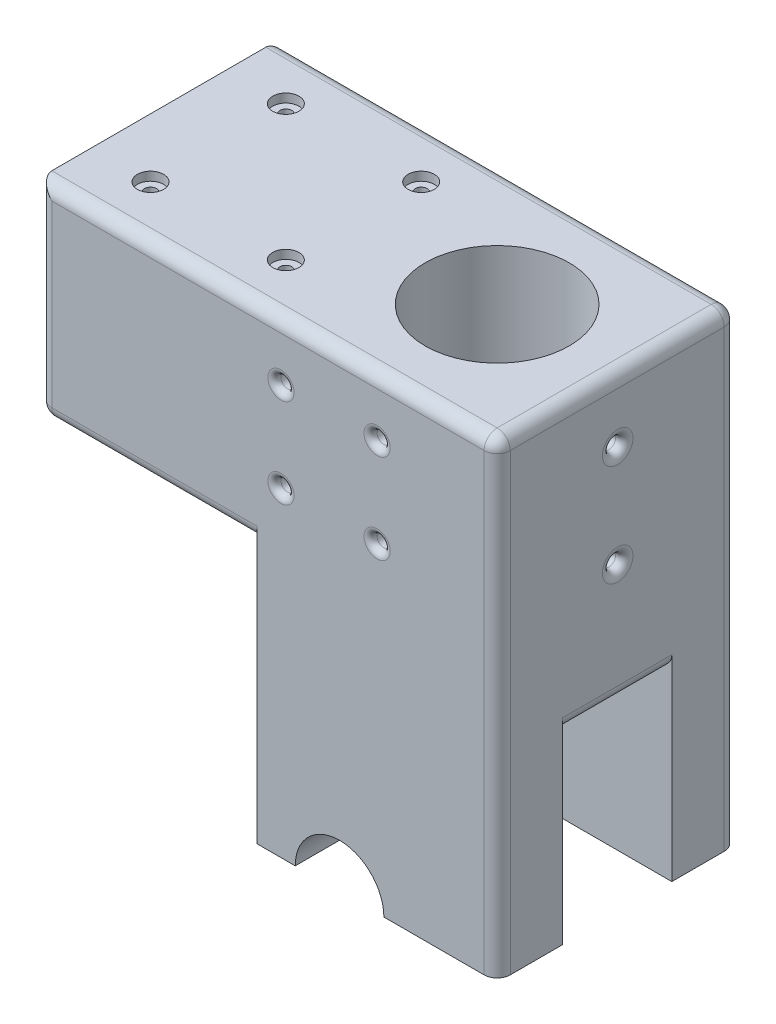
from build123d import *

# Parameters (mm, degrees)
SKETCH1_W               = 65
SKETCH1_H               = 55
BOSS_EXTRUDE1_DEPTH     = 55
SKETCH2_R               = 16.5
CUT_EXTRUDE1_DEPTH      = 55
SKETCH3_W               = 47
SKETCH3_H               = 55
BOSS_EXTRUDE2_DEPTH     = 50
SKETCH5_W               = 42.2
SKETCH5_H               = 42.2
CUT_EXTRUDE2_DEPTH      = 42
SKETCH6_W               = 7.8
SKETCH6_H               = 19.2
CUT_EXTRUDE3_DEPTH      = 42
FILLET2_R               = 3
SKETCH7_W               = 55
SKETCH7_H               = 15
BOSS_EXTRUDE3_DEPTH     = 42
CUT_EXTRUDE4_DEPTH      = 118.976523088
CUT_EXTRUDE4_DEPTH_BACK = 118.976523088
SKETCH9_R               = 10.15
SKETCH10_R              = 1.5
CUT_EXTRUDE5_DEPTH      = 20
FILLET4_R               = 1.5
FILLET5_R               = 3
SKETCH12_R              = 1.35
CUT_EXTRUDE6_DEPTH      = 10
SKETCH13_R              = 3
CUT_EXTRUDE7_DEPTH      = 2
SKETCH15_W              = 20.3
SKETCH15_H              = 3.5
BOSS_EXTRUDE4_DEPTH     = 12
SKETCH16_R              = 1.5
CUT_EXTRUDE8_DEPTH      = 15
FILLET6_R               = 2
SKETCH17_R              = 1.5
CUT_EXTRUDE10_DEPTH     = 15
FILLET7_R               = 1.5


with BuildPart() as part:
    # Sketch1 → Boss-Extrude1 (new body)
    with BuildSketch(Plane(origin=(0, 0, 0), x_dir=(0, 1, 0), z_dir=(0, 0, 1))):
        Rectangle(SKETCH1_W, SKETCH1_H)
    extrude(amount=BOSS_EXTRUDE1_DEPTH)

    # Sketch2 → Cut-Extrude1 (cut)
    with BuildSketch(Plane(origin=(0, 32.5, 0), x_dir=(-1, 0, 0), z_dir=(0, 1, 0))):
        with Locations(Location((0, 27.5, 0), (0, 0, 90))):
            Circle(SKETCH2_R)
    extrude(amount=-CUT_EXTRUDE1_DEPTH, mode=Mode.SUBTRACT)

    # Sketch3 → Boss-Extrude2 (add)
    with BuildSketch(Plane(origin=(-27.5, 0, 0), x_dir=(0, -1, 0), z_dir=(-1, 0, 0))):
        with Locations((-9, 27.5)):
            Rectangle(SKETCH3_W, SKETCH3_H)
    extrude(amount=BOSS_EXTRUDE2_DEPTH)

    # Sketch5 → Cut-Extrude2 (cut)
    with BuildSketch(Plane.XZ.offset(14.5)):
        with Locations((-48.6, 27.5)):
            Rectangle(SKETCH5_W, SKETCH5_H)
    extrude(amount=-CUT_EXTRUDE2_DEPTH, mode=Mode.SUBTRACT)

    # Sketch6 → Cut-Extrude3 (cut)
    with BuildSketch(Plane.XZ.offset(14.5)):
        with Locations((-73.6, 27.5)):
            Rectangle(SKETCH6_W, SKETCH6_H)
    extrude(amount=-CUT_EXTRUDE3_DEPTH, mode=Mode.SUBTRACT)

    # Fillet2
    fillet2_edges = [part.edges().sort_by_distance(p)[0] for p in [
        (-77.5, -14.5, 8.95),
        (-77.5, -14.5, 46.05),
    ]]
    fillet(fillet2_edges, radius=FILLET2_R)

    # Sketch7 → Boss-Extrude3 (add)
    with BuildSketch(Plane.XZ.offset(32.5)):
        with Locations((0, 47.5)):
            Rectangle(SKETCH7_W, SKETCH7_H)
        with Locations((0, 7.5)):
            Rectangle(SKETCH7_W, SKETCH7_H)
    extrude(amount=BOSS_EXTRUDE3_DEPTH)

    # Sketch9 → Cut-Extrude4 (cut, two sides: drawn at the far end of the back side and taken through both)
    with BuildSketch(Plane(origin=(0, 0, 48.6), x_dir=(1, 0, 0), z_dir=(0, 0, -1)).offset(-CUT_EXTRUDE4_DEPTH_BACK)):
        with Locations((-8.6, 74.5)):
            Circle(SKETCH9_R)
    extrude(amount=CUT_EXTRUDE4_DEPTH + CUT_EXTRUDE4_DEPTH_BACK, mode=Mode.SUBTRACT)

    # Sketch10 → Cut-Extrude5 (cut)
    with BuildSketch(Plane.XZ.offset(74.5)):
        with Locations(Location((-23.125, 51.25, 0), (0, 0, 270))):
            Circle(SKETCH10_R)
        with Locations(Location((-23.125, 43.75, 0), (0, 0, 270))):
            Circle(SKETCH10_R)
        with Locations(Location((8.0375, 47.5, 0), (0, 0, 270))):
            Circle(SKETCH10_R)
        with Locations(Location((21.0125, 47.5, 0), (0, 0, 270))):
            Circle(SKETCH10_R)
        with Locations(Location((-23.125, 11.25, 0), (0, 0, 270))):
            Circle(SKETCH10_R)
        with Locations(Location((-23.125, 3.75, 0), (0, 0, 270))):
            Circle(SKETCH10_R)
        with Locations(Location((8.0375, 7.5, 0), (0, 0, 270))):
            Circle(SKETCH10_R)
        with Locations(Location((21.0125, 7.5, 0), (0, 0, 270))):
            Circle(SKETCH10_R)
    extrude(amount=-CUT_EXTRUDE5_DEPTH, mode=Mode.SUBTRACT)

    # Fillet4
    fillet4_edges = [part.edges().sort_by_distance(p)[0] for p in [
        (-23.125, -74.5, 52.75),
        (-23.125, -74.5, 12.75),
        (21.0125, -74.5, 49),
        (8.0375, -74.5, 49),
        (-23.125, -74.5, 45.25),
        (-23.125, -74.5, 5.25),
        (8.0375, -74.5, 9),
        (21.0125, -74.5, 9),
    ]]
    fillet(fillet4_edges, radius=FILLET4_R)

    # Fillet5
    fillet5_edges = [part.edges().sort_by_distance(p)[0] for p in [
        (27.5, -21, 55),
        (-77.5, 10.5, 0),
        (-25, 32.5, 55),
        (27.5, -21, 0),
        (-25, 32.5, 0),
        (-77.5, 10.5, 55),
        (-51, -14.5, 55),
        (-76.621320344, -13.621320344, 55),
        (-51, -14.5, 0),
        (-76.621320344, -13.621320344, 0),
        (27.5, -32.5, 27.5),
        (-27.5, -32.5, 27.5),
        (27.5, 32.5, 27.5),
    ]]
    fillet(fillet5_edges, radius=FILLET5_R)

    # Sketch12 → Cut-Extrude6 (cut)
    with BuildSketch(Plane(origin=(0, 32.5, 0), x_dir=(1, 0, 0), z_dir=(0, 1, 0))):
        with Locations(Location((-33, -42.9, 0), (0, 0, 270))):
            Circle(SKETCH12_R)
        with Locations(Location((-33, -11.9, 0), (0, 0, 270))):
            Circle(SKETCH12_R)
        with Locations(Location((-64, -42.9, 0), (0, 0, 270))):
            Circle(SKETCH12_R)
        with Locations(Location((-64, -11.9, 0), (0, 0, 270))):
            Circle(SKETCH12_R)
    extrude(amount=-CUT_EXTRUDE6_DEPTH, mode=Mode.SUBTRACT)

    # Sketch13 → Cut-Extrude7 (cut)
    with BuildSketch(Plane(origin=(0, 32.5, 0), x_dir=(1, 0, 0), z_dir=(0, 1, 0))):
        with Locations(Location((-33, -42.9, 0), (0, 0, 270))):
            Circle(SKETCH13_R)
        with Locations(Location((-64, -42.9, 0), (0, 0, 270))):
            Circle(SKETCH13_R)
        with Locations(Location((-33, -11.9, 0), (0, 0, 270))):
            Circle(SKETCH13_R)
        with Locations(Location((-64, -11.9, 0), (0, 0, 270))):
            Circle(SKETCH13_R)
    extrude(amount=-CUT_EXTRUDE7_DEPTH, mode=Mode.SUBTRACT)

    # Sketch15 → Boss-Extrude4 (add)
    with BuildSketch(Plane.XZ.offset(74.5)):
        with Locations((-8.6, 1.75)):
            Rectangle(SKETCH15_W, SKETCH15_H)
    extrude(amount=-BOSS_EXTRUDE4_DEPTH)

    # Sketch16 → Cut-Extrude8 (cut)
    with BuildSketch(Plane.YZ.offset(27.5)):
        with Locations(Location((-5.4, 27.4, 0), (0, 0, 270))):
            Circle(SKETCH16_R)
        with Locations(Location((17.9, 27.4, 0), (0, 0, 270))):
            Circle(SKETCH16_R)
    extrude(amount=-CUT_EXTRUDE8_DEPTH, mode=Mode.SUBTRACT)

    # Fillet6
    fillet6_edges = [part.edges().sort_by_distance(p)[0] for p in [
        (27.5, -5.4, 28.9),
        (27.5, 17.9, 28.9),
    ]]
    fillet(fillet6_edges, radius=FILLET6_R)

    # Sketch17 → Cut-Extrude10 (cut)
    with BuildSketch(Plane.XY.offset(55)):
        with Locations((0.002383592, 19.25)):
            Circle(SKETCH17_R)
        with Locations((0.002383592, -1.25)):
            Circle(SKETCH17_R)
        with Locations((-22.017934674, 19.25)):
            Circle(SKETCH17_R)
        with Locations((-22.017934674, -1.25)):
            Circle(SKETCH17_R)
    extrude(amount=-CUT_EXTRUDE10_DEPTH, mode=Mode.SUBTRACT)

    # Fillet7
    fillet7_edges = [part.edges().sort_by_distance(p)[0] for p in [
        (-1.497616408, -1.25, 55),
        (-23.517934674, 19.25, 55),
        (-23.517934674, -1.25, 55),
        (-1.497616408, 19.25, 55),
    ]]
    fillet(fillet7_edges, radius=FILLET7_R)


solid = part.part
